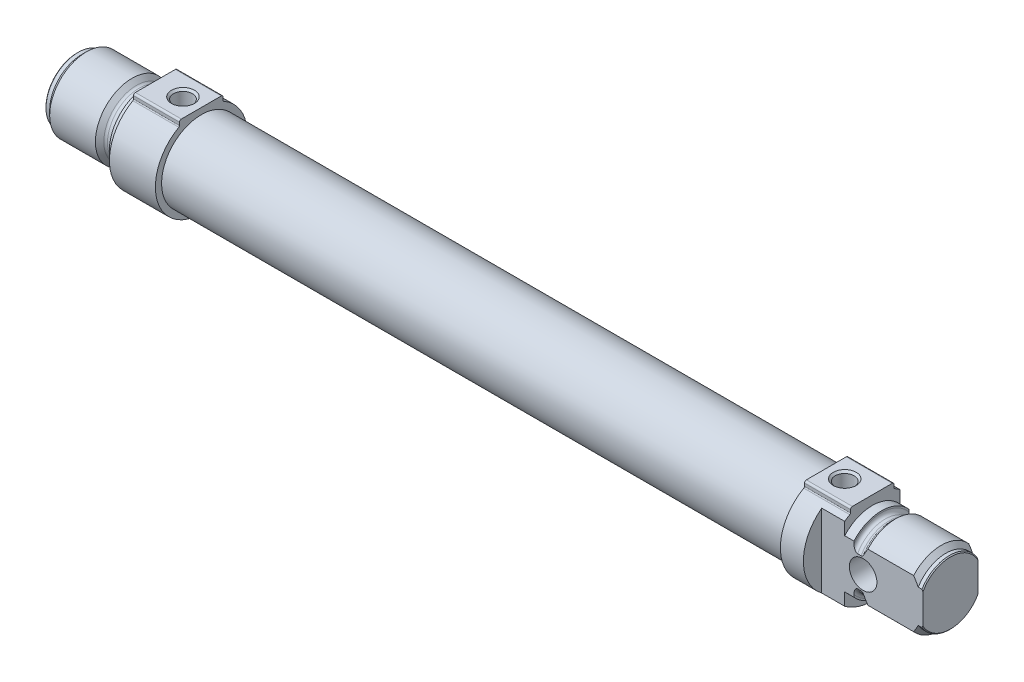
from build123d import *

# Parameters (mm, degrees)
BOSS_EXTRUDE1_DEPTH     = 10
SKETCH3_W               = 136
SKETCH3_H               = 8.65
BOSS_EXTRUDE2_DEPTH     = 10
CUT_EXTRUDE1_DEPTH      = 10
CUT_EXTRUDE1_DEPTH_BACK = 10
SKETCH7_W               = 12
SKETCH7_H               = 3
HOLE1_D                 = 4.134
HOLE1_DEPTH             = 10
HOLE1_CSINK_D           = 5
HOLE1_CSINK_ANGLE       = 90
HOLE2_D                 = 4.134
HOLE2_DEPTH             = 11
HOLE2_CSINK_D           = 5
HOLE2_CSINK_ANGLE       = 90
HOLE2_TIP               = 1.193383006


with BuildPart() as part:
    # Sketch1 → Revolve1 (revolve)
    with BuildSketch(Plane.XY):
        with BuildLine():
            Line((0, 0), (0, 6.8))
            Line((0, 6.8), (0.2, 7))
            Line((0.2, 7), (1, 7))
            Line((1, 7), (2, 8))
            Line((2, 8), (11.95, 8))
            Line((11.95, 8), (12.865685425, 7.084314575))
            ThreePointArc((12.865685425, 7.084314575), (13.125224104, 6.910896374), (13.43137085, 6.85))
            Line((13.43137085, 6.85), (14.2, 6.85))
            ThreePointArc((14.2, 6.85), (14.765685425, 7.084314575), (15, 7.65))
            Line((15, 7.65), (15, 8))
            Line((15, 8), (17, 8))
            Line((17, 8), (17, 0))
            Line((17, 0), (0, 0))
        make_face()
    revolve(axis=Axis((17, 0, 0), (-1, 0, 0)))

    # Sketch2 → Boss-Extrude1 (add)
    with BuildSketch(Plane(origin=(17, 0, 0), x_dir=(0, 0, -1), z_dir=(1, 0, 0))):
        with BuildLine():
            Line((4.75, 8.977054082), (4.75, 9.6))
            ThreePointArc((4.75, 9.6), (4.632842712, 9.882842712), (4.35, 10))
            Line((4.35, 10), (-4.35, 10))
            ThreePointArc((-4.35, 10), (-4.632842712, 9.882842712), (-4.75, 9.6))
            Line((-4.75, 9.6), (-4.75, 8.977054082))
            ThreePointArc((-4.75, 8.977054082), (-4.791034545, 8.825604773), (-4.902912621, 8.715586488))
            ThreePointArc((-4.902912621, 8.715586488), (0, -10), (4.902912621, 8.715586488))
            ThreePointArc((4.902912621, 8.715586488), (4.791034545, 8.825604773), (4.75, 8.977054082))
        make_face()
    extrude(amount=BOSS_EXTRUDE1_DEPTH)

    # Sketch3 → Revolve2 (revolve)
    with BuildSketch(Plane.XY):
        with Locations((95, 4.325)):
            Rectangle(SKETCH3_W, SKETCH3_H)
    revolve(axis=Axis((163, 0, 0), (-1, 0, 0)))

    # Sketch4 → Boss-Extrude2 (add)
    with BuildSketch(Plane(origin=(163, 0, 0), x_dir=(0, 0, -1), z_dir=(1, 0, 0))):
        with BuildLine():
            Line((4.75, 8.977054082), (4.75, 9.6))
            ThreePointArc((4.75, 9.6), (4.632842712, 9.882842712), (4.35, 10))
            Line((4.35, 10), (-4.35, 10))
            ThreePointArc((-4.35, 10), (-4.632842712, 9.882842712), (-4.75, 9.6))
            Line((-4.75, 9.6), (-4.75, 8.977054082))
            ThreePointArc((-4.75, 8.977054082), (-4.791034545, 8.825604773), (-4.902912621, 8.715586488))
            ThreePointArc((-4.902912621, 8.715586488), (0, -10), (4.902912621, 8.715586488))
            ThreePointArc((4.902912621, 8.715586488), (4.791034545, 8.825604773), (4.75, 8.977054082))
        make_face()
    extrude(amount=BOSS_EXTRUDE2_DEPTH)

    # Sketch5 → Revolve3 (revolve)
    with BuildSketch(Plane.XY):
        with BuildLine():
            Line((173, 0), (173, 8))
            Line((173, 8), (175, 8))
            Line((175, 8), (175, 7.65))
            ThreePointArc((175, 7.65), (175.234314575, 7.084314575), (175.8, 6.85))
            Line((175.8, 6.85), (176.56862915, 6.85))
            ThreePointArc((176.56862915, 6.85), (176.874775896, 6.910896374), (177.134314575, 7.084314575))
            Line((177.134314575, 7.084314575), (178.05, 8))
            Line((178.05, 8), (188, 8))
            Line((188, 8), (189, 7))
            Line((189, 7), (189.8, 7))
            Line((189.8, 7), (190, 6.8))
            Line((190, 6.8), (190, 0))
            Line((190, 0), (173, 0))
        make_face()
    revolve(axis=Axis((190, 0, 0), (-1, 0, 0)))

    # Sketch6 → Cut-Extrude1 (cut, two sides: drawn at the far end of the back side and taken through both)
    with BuildSketch(Plane(origin=(0, 0, 0), x_dir=(1, 0, 0), z_dir=(0, 1, 0)).offset(-CUT_EXTRUDE1_DEPTH_BACK)):
        Polygon((168, 18), (168, 6), (190, 6), (190, -6), (168, -6), (168, -18), (202, -18), (202, 18), align=None)
    extrude(amount=CUT_EXTRUDE1_DEPTH + CUT_EXTRUDE1_DEPTH_BACK, mode=Mode.SUBTRACT)

    # Sketch7 → Cut-Revolve1 (revolve, cut)
    with BuildSketch(Plane(origin=(177, 0, 0), x_dir=(0, 0, -1), z_dir=(1, 0, 0))):
        with Locations((0, 1.5)):
            Rectangle(SKETCH7_W, SKETCH7_H)
    revolve(axis=Axis((177, 0, -6), (0, 0, 1)), mode=Mode.SUBTRACT)

    # Hole1
    with Locations(Plane(origin=(0, 10, 0), x_dir=(1, 0, 0), z_dir=(0, 1, 0))):
        with Locations((23, 0)):
            CounterSinkHole(HOLE1_D / 2, HOLE1_CSINK_D / 2, depth=HOLE1_DEPTH, counter_sink_angle=HOLE1_CSINK_ANGLE)

    # Hole2
    with Locations(Plane(origin=(0, 10, 0), x_dir=(1, 0, 0), z_dir=(0, 1, 0))):
        with Locations((167, 0)):
            CounterSinkHole(HOLE2_D / 2, HOLE2_CSINK_D / 2, depth=HOLE2_DEPTH, counter_sink_angle=HOLE2_CSINK_ANGLE)
            with Locations((0, 0, -(HOLE2_DEPTH + HOLE2_TIP / 2))):  # 120° drill point
                Cone(0, HOLE2_D / 2, HOLE2_TIP, mode=Mode.SUBTRACT)

    # Sketch12 → Cut-Revolve2 (revolve, cut)
    with BuildSketch(Plane.XY):
        Polygon((-5, 0), (-5, 3), (41.2, 3), (41.2, 8), (145.2, 8), (145.2, 0), align=None)
    revolve(axis=Axis((145.2, 0, 0), (-1, 0, 0)), mode=Mode.SUBTRACT)


solid = part.part
